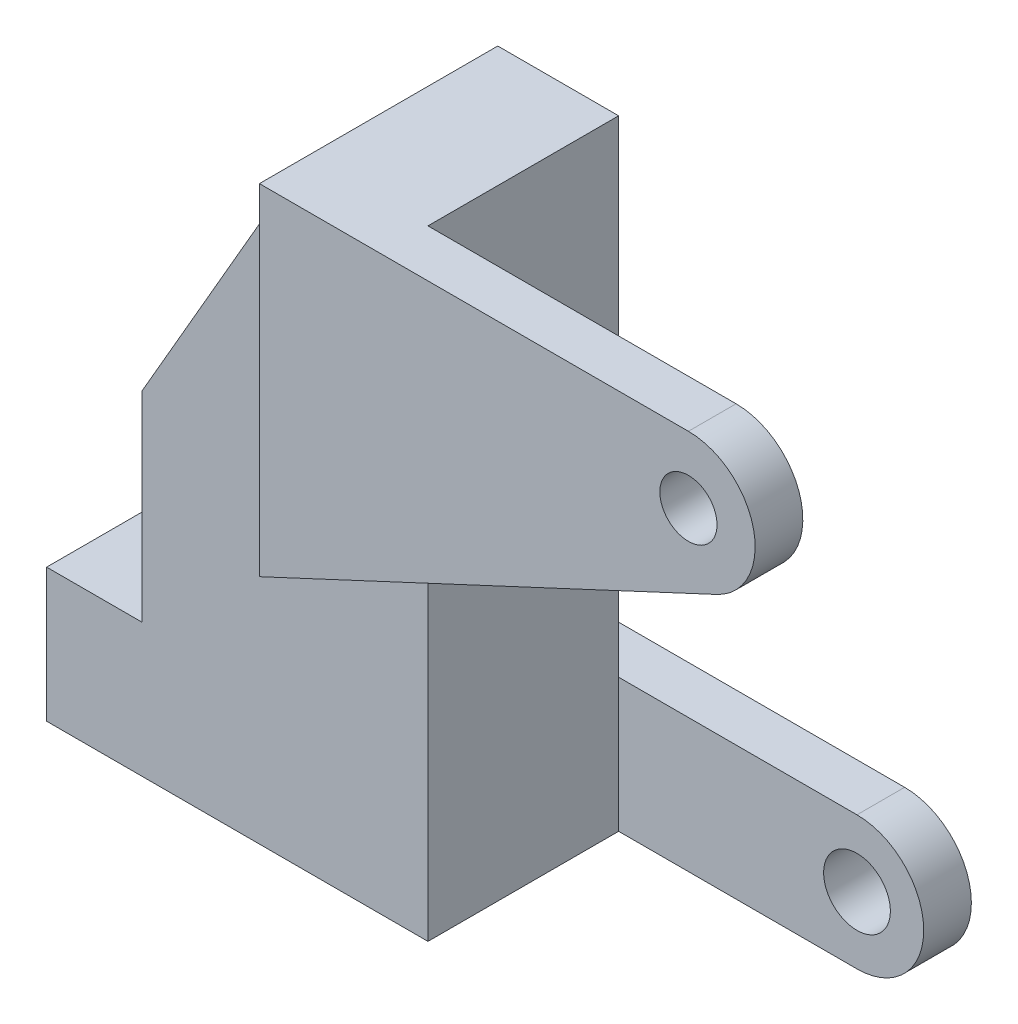
from build123d import *

# Parameters (mm, degrees)
BOSS_EXTRUDE1_DEPTH = 20
SKETCH2_R           = 7
SKETCH2_R_2         = 3
BOSS_EXTRUDE2_DEPTH = 5
SKETCH3_W           = 30
SKETCH3_H           = 14
SKETCH3_R           = 7
SKETCH3_R_2         = 3.5
BOSS_EXTRUDE3_DEPTH = 5


with BuildPart() as part:
    # Sketch1 → Boss-Extrude1 (new body)
    with BuildSketch(Plane.XY):
        Polygon((0, 0), (40, 0), (40, 65), (27.320508076, 65), (10, 35), (10, 14), (0, 14), align=None)
    extrude(amount=BOSS_EXTRUDE1_DEPTH)

    # Sketch2 → Boss-Extrude2 (add)
    # profile 1 of 3: a face of its own
    with BuildSketch(Plane.XY.offset(20)):
        Polygon((40, 65), (27.320508076, 65), (27.320508076, 29.29250995), (40, 35.205054136), align=None)
    # profile 2 of 3: a face of its own
    with BuildSketch(Plane.XY.offset(20)):
        with BuildLine():
            Line((72.320508076, 65), (40, 65))
            Line((40, 65), (40, 35.205054136))
            Line((40, 35.205054136), (75.278835908, 51.655845491))
            ThreePointArc((75.278835908, 51.655845491), (65.486436026, 56.484922702), (72.320508076, 65))
        make_face()
    # profile 3 of 3: a face of its own
    with BuildSketch(Plane.XY.offset(20)):
        with Locations((72.320508076, 58)):
            Circle(SKETCH2_R)
        with Locations((72.320508076, 58)):
            Circle(SKETCH2_R_2, mode=Mode.SUBTRACT)
    extrude(amount=BOSS_EXTRUDE2_DEPTH)

    # Sketch3 → Boss-Extrude3 (add)
    # profile 1 of 3: a face of its own
    with BuildSketch(Plane(origin=(0, 0, 0), x_dir=(-1, 0, 0), z_dir=(0, 0, -1))):
        with BuildLine():
            Line((-40, 0), (-40, 14))
            Line((-40, 14), (-65, 14))
            ThreePointArc((-65, 14), (-60.050252532, 11.949747468), (-58, 7))
            ThreePointArc((-58, 7), (-60.050252532, 2.050252532), (-65, 0))
            Line((-65, 0), (-40, 0))
        make_face()
    # profile 2 of 3: a face of its own
    with BuildSketch(Plane(origin=(0, 0, 0), x_dir=(-1, 0, 0), z_dir=(0, 0, -1))):
        with Locations((-25, 7)):
            Rectangle(SKETCH3_W, SKETCH3_H)
    # profile 3 of 3: a face of its own
    with BuildSketch(Plane(origin=(0, 0, 0), x_dir=(-1, 0, 0), z_dir=(0, 0, -1))):
        with Locations((-65, 7)):
            Circle(SKETCH3_R)
        with Locations((-65, 7)):
            Circle(SKETCH3_R_2, mode=Mode.SUBTRACT)
    extrude(amount=BOSS_EXTRUDE3_DEPTH)


solid = part.part
